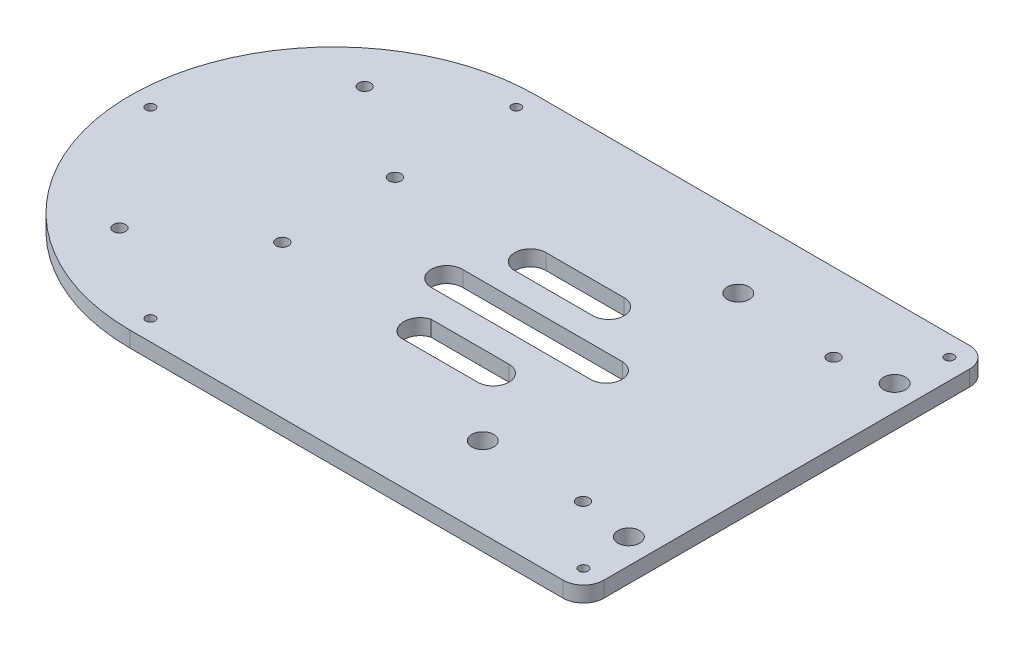
from build123d import *

# Parameters (mm, degrees)
SKETCH1_R           = 3.5
SKETCH1_R_2         = 1.95
SKETCH1_R_3         = 1.475
SKETCH1_R_4         = 1.975
BOSS_EXTRUDE2_DEPTH = 5


with BuildPart() as part:
    # Sketch1 → Boss-Extrude2 (new body)
    with BuildSketch(Plane(origin=(0, 0, 0), x_dir=(1, 0, 0), z_dir=(0, 1, 0))):
        with BuildLine():
            Line((76.836482479, 56.919157308), (76.836482479, -60.080842545))
            ThreePointArc((76.836482479, -60.080842545), (74.932676609, -64.677036718), (70.336482479, -66.580842692))
            Line((70.336482479, -66.580842692), (-68.163517521, -66.580842545))
            ThreePointArc((-68.163517521, -66.580842545), (-133.166606879, -1.580842619), (-68.163517521, 63.419157308))
            Line((-68.163517521, 63.419157308), (70.336482479, 63.419157308))
            ThreePointArc((70.336482479, 63.419157308), (74.932676557, 61.515351386), (76.836482479, 56.919157308))
        make_face()
        with Locations(Location((18.836482479, 40.919291459, 0), (0, 0, 270))):
            Circle(SKETCH1_R, mode=Mode.SUBTRACT)
        with Locations(Location((51.836482479, 38.419157308, 0), (0, 0, 270))):
            Circle(SKETCH1_R_2, mode=Mode.SUBTRACT)
        with Locations(Location((68.836482479, 40.919291459, 0), (0, 0, 270))):
            Circle(SKETCH1_R, mode=Mode.SUBTRACT)
        with Locations(Location((70.336482479, 56.919157308, 0), (0, 0, 270))):
            Circle(SKETCH1_R_3, mode=Mode.SUBTRACT)
        with Locations(Location((18.836482479, -40.800748124, 0), (0, 0, 90))):
            Circle(SKETCH1_R, mode=Mode.SUBTRACT)
        with Locations(Location((70.336482479, -60.080842692, 0), (0, 0, 90))):
            Circle(SKETCH1_R_3, mode=Mode.SUBTRACT)
        with Locations(Location((51.685487167, -41.580700194, 0), (0, 0, 90))):
            Circle(SKETCH1_R_2, mode=Mode.SUBTRACT)
        with Locations(Location((68.836482479, -44.080708541, 0), (0, 0, 90))):
            Circle(SKETCH1_R, mode=Mode.SUBTRACT)
        with Locations(Location((-68.163517521, 56.919157308, 0), (0, 0, 270))):
            Circle(SKETCH1_R_3, mode=Mode.SUBTRACT)
        with Locations(Location((-98.163517521, 38.419157308, 0), (0, 0, 270))):
            Circle(SKETCH1_R_2, mode=Mode.SUBTRACT)
        with Locations(Location((-68.163517521, 18.109648094, 0), (0, 0, 270))):
            Circle(SKETCH1_R_4, mode=Mode.SUBTRACT)
        with Locations(Location((-68.163517521, -17.890351906, 0), (0, 0, 90))):
            Circle(SKETCH1_R_4, mode=Mode.SUBTRACT)
        with Locations(Location((-98.163517521, -40.000000036, 0), (0, 0, 90))):
            Circle(SKETCH1_R_2, mode=Mode.SUBTRACT)
        with Locations(Location((-68.163517521, -60.080842545, 0), (0, 0, 90))):
            Circle(SKETCH1_R_3, mode=Mode.SUBTRACT)
        with Locations(Location((-126.663517521, -1.580842619, 0), (0, 0, 270))):
            Circle(SKETCH1_R_3, mode=Mode.SUBTRACT)
        with BuildLine():
            Line((-31.663517521, 3.419157346), (19.336482479, 3.419157346))
            ThreePointArc((19.336482479, 3.419157346), (24.121172968, -1.796152166), (18.905863456, -6.580842654))
            Line((18.905863456, -6.580842654), (-32.094136544, -6.580842654))
            ThreePointArc((-32.094136544, -6.580842654), (-36.878827032, -1.365533142), (-31.663517521, 3.419157346))
        make_face(mode=Mode.SUBTRACT)
        with BuildLine():
            Line((-23.163517274, 21.419157346), (1.836482479, 21.419157346))
            ThreePointArc((1.836482479, 21.419157346), (6.836482479, 16.419157346), (1.836482479, 11.419157346))
            Line((1.836482479, 11.419157346), (-23.163517274, 11.419157346))
            ThreePointArc((-23.163517274, 11.419157346), (-28.163517274, 16.419157346), (-23.163517274, 21.419157346))
        make_face(mode=Mode.SUBTRACT)
        with BuildLine():
            Line((-23.166606879, -25.419653269), (1.833393121, -25.419653269))
            ThreePointArc((1.833393121, -25.419653269), (6.833393121, -20.419653269), (1.833393121, -15.419653269))
            Line((1.833393121, -15.419653269), (-23.166606879, -15.419653269))
            ThreePointArc((-23.166606879, -15.419653269), (-26.786365539, -20.419653269), (-23.166606879, -25.419653269))
        make_face(mode=Mode.SUBTRACT)
    extrude(amount=BOSS_EXTRUDE2_DEPTH)


solid = part.part
